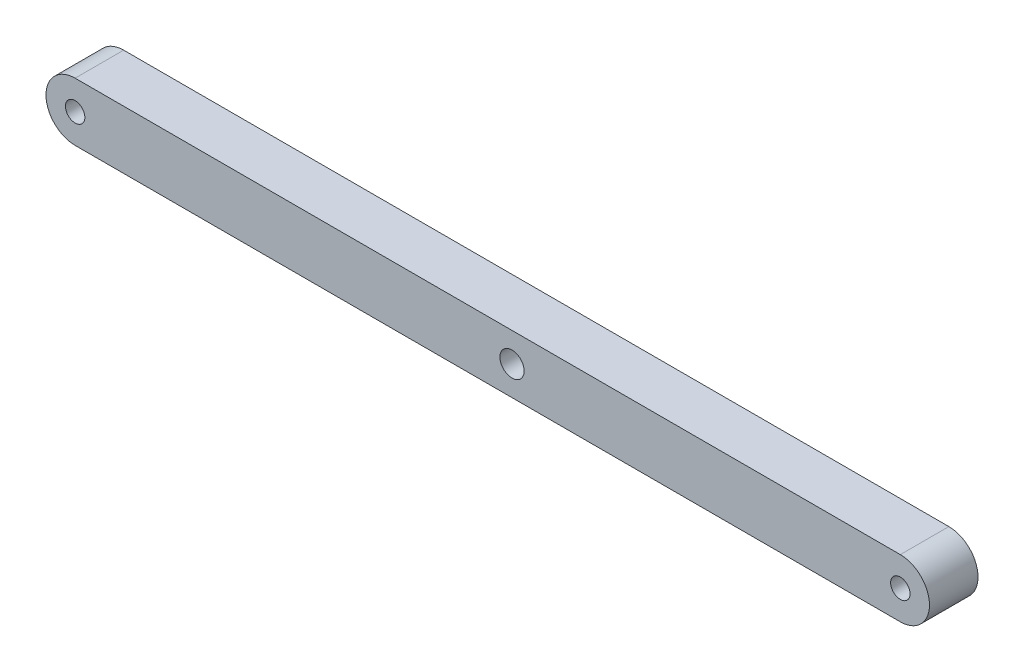
from build123d import *

# Parameters (mm, degrees)
SKETCH1_R           = 1
SKETCH1_R_2         = 1.25
BOSS_EXTRUDE1_DEPTH = 5


with BuildPart() as part:
    # Sketch1 → Boss-Extrude1 (new body)
    with BuildSketch(Plane.XY):
        with BuildLine():
            Line((0, 3), (85, 3))
            ThreePointArc((85, 3), (88, 0), (85, -3))
            Line((85, -3), (0, -3))
            ThreePointArc((0, -3), (-3, 0), (0, 3))
        make_face()
        Circle(SKETCH1_R, mode=Mode.SUBTRACT)
        with Locations((85, 0)):
            Circle(SKETCH1_R, mode=Mode.SUBTRACT)
        with Locations((45, 0)):
            Circle(SKETCH1_R_2, mode=Mode.SUBTRACT)
    extrude(amount=BOSS_EXTRUDE1_DEPTH)


solid = part.part
